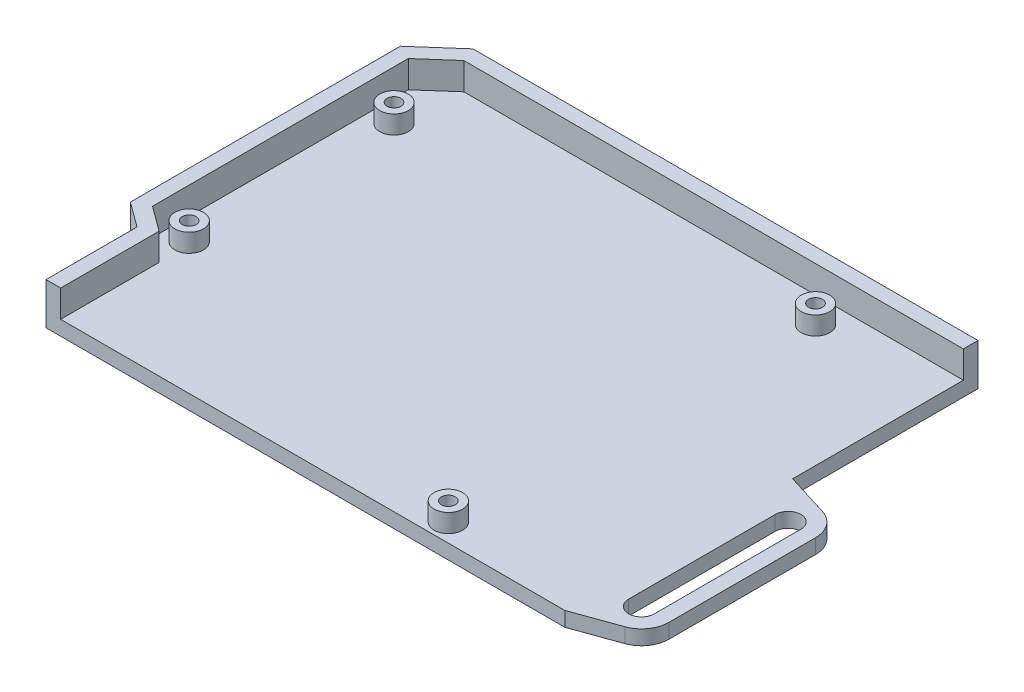
from build123d import *

# Parameters (mm, degrees)
SALIENTE_EXTRUIR2_DEPTH = 2
SALIENTE_EXTRUIR3_DEPTH = 3.7
CROQUIS3_R              = 1.95
CROQUIS3_R_2            = 0.95
SALIENTE_EXTRUIR4_DEPTH = 2.5


with BuildPart() as part:
    # Croquis1 → Saliente-Extruir2 (new body)
    with BuildSketch(Plane(origin=(0, 0, 0), x_dir=(1, 0, 0), z_dir=(0, 1, 0))):
        with BuildLine():
            Line((70.799071053, 31.092568315), (70.799071053, 56.4))
            Line((70.799071053, 56.4), (1.865918726, 56.4))
            Line((1.865918726, 56.4), (-3.400928947, 51.75405083))
            Line((-3.400928947, 51.75405083), (-3.400928947, 14.921940047))
            Line((-3.400928947, 14.921940047), (0, 12.421940047))
            Line((0, 12.421940047), (0, 0))
            Line((0, 0), (70.799071053, 0))
            Line((70.799071053, 0), (76.842269578, 2.170786153))
            ThreePointArc((76.842269578, 2.170786153), (78.641822821, 3.542629227), (79.324535526, 5.7))
            Line((79.324535526, 5.7), (79.324535526, 25.7))
            ThreePointArc((79.324535526, 25.7), (78.590944159, 27.927953986), (76.677186746, 29.284223805))
            Line((76.677186746, 29.284223805), (70.799071053, 31.092568315))
        make_face()
        with BuildLine():
            Line((77.324535526, 25.7), (77.324535526, 5.7))
            ThreePointArc((77.324535526, 5.7), (75.574535526, 3.95), (73.824535526, 5.7))
            Line((73.824535526, 5.7), (73.824535526, 25.7))
            ThreePointArc((73.824535526, 25.7), (75.574535526, 27.45), (77.324535526, 25.7))
        make_face(mode=Mode.SUBTRACT)
    extrude(amount=SALIENTE_EXTRUIR2_DEPTH)

    # Croquis2 → Saliente-Extruir3 (add)
    with BuildSketch(Plane(origin=(0, 2, 0), x_dir=(1, 0, 0), z_dir=(0, 1, 0))):
        Polygon((70.799071053, 54.4), (2.621972909, 54.4), (-1.400928947, 50.851350277), (-1.400928947, 15.933980016), (2, 13.433980016), (2, 0), (0, 0), (0, 12.421940047), (-3.400928947, 14.921940047), (-3.400928947, 51.75405083), (1.865918726, 56.4), (70.799071053, 56.4), align=None)
    extrude(amount=SALIENTE_EXTRUIR3_DEPTH)

    # Croquis3 → Saliente-Extruir4 (add)
    # profile 1 of 4: a face of its own
    with BuildSketch(Plane(origin=(0, 2, 0), x_dir=(1, 0, 0), z_dir=(0, 1, 0))):
        with Locations(Location((1.599071053, 45.9, 0), (0, 0, 270))):
            Circle(CROQUIS3_R)
        with Locations(Location((1.599071053, 45.9, 0), (0, 0, 270))):
            Circle(CROQUIS3_R_2, mode=Mode.SUBTRACT)
    # profile 2 of 4: a face of its own
    with BuildSketch(Plane(origin=(0, 2, 0), x_dir=(1, 0, 0), z_dir=(0, 1, 0))):
        with Locations(Location((1.599071053, 17.94, 0), (0, 0, 270))):
            Circle(CROQUIS3_R)
        with Locations(Location((1.599071053, 17.94, 0), (0, 0, 270))):
            Circle(CROQUIS3_R_2, mode=Mode.SUBTRACT)
    # profile 3 of 4: a face of its own
    with BuildSketch(Plane(origin=(0, 2, 0), x_dir=(1, 0, 0), z_dir=(0, 1, 0))):
        with Locations(Location((52.409071053, 2.505, 0), (0, 0, 270))):
            Circle(CROQUIS3_R)
        with Locations(Location((52.409071053, 2.505, 0), (0, 0, 270))):
            Circle(CROQUIS3_R_2, mode=Mode.SUBTRACT)
    # profile 4 of 4: a face of its own
    with BuildSketch(Plane(origin=(0, 2, 0), x_dir=(1, 0, 0), z_dir=(0, 1, 0))):
        with Locations(Location((54.119071053, 50.9, 0), (0, 0, 270))):
            Circle(CROQUIS3_R)
        with Locations(Location((54.119071053, 50.9, 0), (0, 0, 270))):
            Circle(CROQUIS3_R_2, mode=Mode.SUBTRACT)
    extrude(amount=SALIENTE_EXTRUIR4_DEPTH)


solid = part.part
